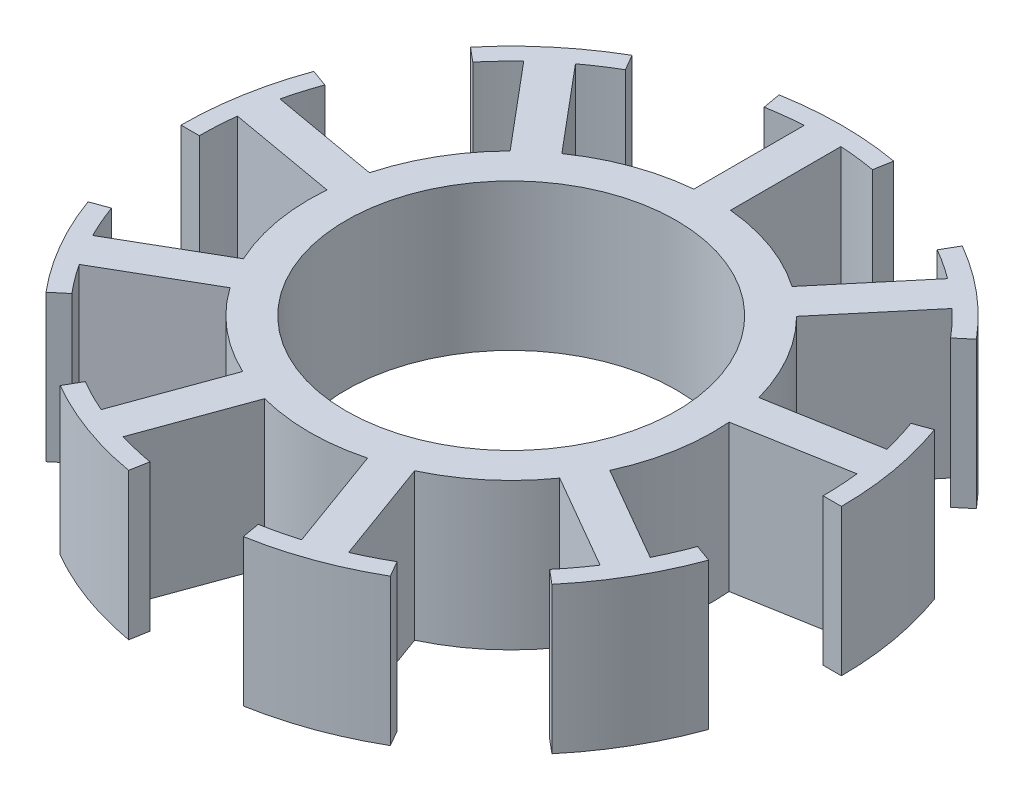
from build123d import *

# Parameters (mm, degrees)
SKETCH1_R           = 9
BOSS_EXTRUDE1_DEPTH = 8
BOSS_EXTRUDE4_DEPTH = 8
CIRPATTERN2_COUNT   = 9


with BuildPart() as part:
    # Sketch1 → Boss-Extrude1 (new body)
    with BuildSketch(Plane(origin=(0, 0, 0), x_dir=(1, 0, 0), z_dir=(0, 1, 0))):
        with BuildLine():
            ThreePointArc((1, 10.95445115), (0, 11), (-1, 10.95445115))
            ThreePointArc((-1, 10.95445115), (-7.416198487, -8.124038405), (11, 0))
            ThreePointArc((11, 0), (8.124038405, 7.416198487), (1, 10.95445115))
        make_face()
        Circle(SKETCH1_R, mode=Mode.SUBTRACT)
    extrude(amount=BOSS_EXTRUDE1_DEPTH)

    # Sketch1<3> → Boss-Extrude4 (add)
    with BuildSketch(Plane(origin=(0, 0, 0), x_dir=(1, 0, 0), z_dir=(0, 1, 0))):
        with BuildLine():
            Line((-1, 16.970562748), (-1, 10.95445115))
            ThreePointArc((-1, 10.95445115), (0, 11), (1, 10.95445115))
            Line((1, 10.95445115), (1, 16.970562748))
            ThreePointArc((1, 16.970562748), (1.979319197, 16.884380223), (2.95201902, 16.741731801))
            Line((2.95201902, 16.741731801), (3.125667198, 17.726539554))
            ThreePointArc((3.125667198, 17.726539554), (0, 18), (-3.125667198, 17.726539554))
            Line((-3.125667198, 17.726539554), (-2.95201902, 16.741731801))
            ThreePointArc((-2.95201902, 16.741731801), (-1.979319197, 16.884380223), (-1, 16.970562748))
        make_face()
    boss_extrude4 = extrude(amount=BOSS_EXTRUDE4_DEPTH)

    # CirPattern2: Boss-Extrude4 ×9 about axis
    cirpattern2_axis = Axis((0, 8, 0), (0, -1, 0))
    for i in range(1, CIRPATTERN2_COUNT):
        add(boss_extrude4.rotate(cirpattern2_axis, i * 360 / CIRPATTERN2_COUNT))


solid = part.part
